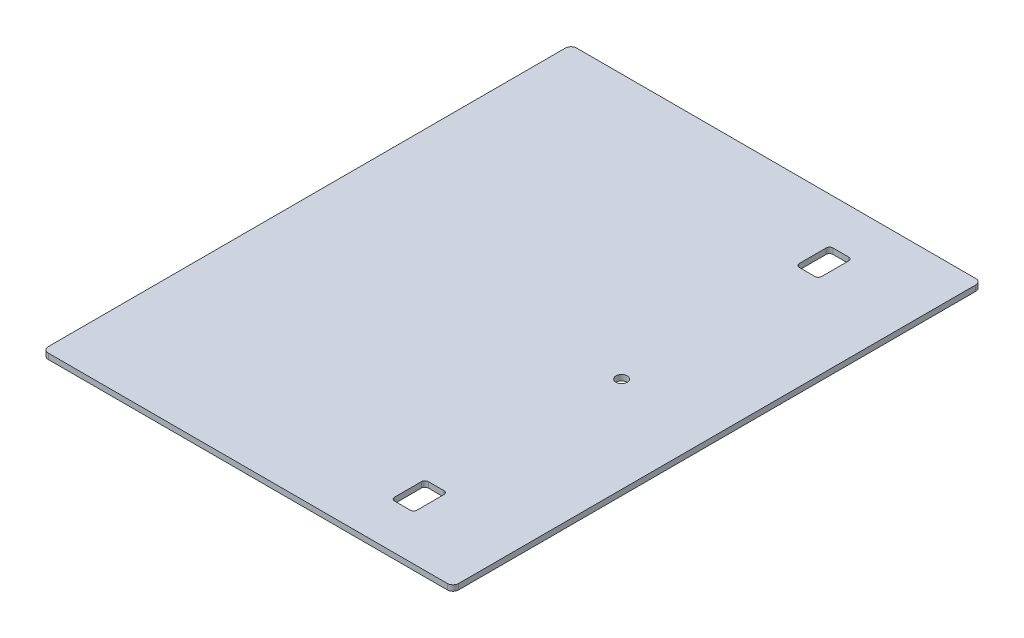
from build123d import *

# Parameters (mm, degrees)
SKETCH1_W                   = 231.775
SKETCH1_H                   = 298.45
BOSS_EXTRUDE1_DEPTH         = 3.175
F_1_4_0_25_DIAMETER_HOLE1_D = 6.35
FILLET1_R                   = 3.175
SKETCH4_W                   = 12.7
SKETCH4_H                   = 19.05
CUT_EXTRUDE1_DEPTH          = 189.96585381
FILLET2_R                   = 1.905


with BuildPart() as part:
    # Sketch1 → Boss-Extrude1 (new body)
    with BuildSketch(Plane(origin=(0, 0, 0), x_dir=(1, 0, 0), z_dir=(0, 1, 0))):
        Rectangle(SKETCH1_W, SKETCH1_H)
    extrude(amount=BOSS_EXTRUDE1_DEPTH)

    # 1/4 (0.25) Diameter Hole1 (through all)
    with Locations(Plane(origin=(0, 3.175, 0), x_dir=(1, 0, 0), z_dir=(0, 1, 0))):
        with Locations((61.9125, 0)):
            Hole(F_1_4_0_25_DIAMETER_HOLE1_D / 2)

    # Fillet1
    fillet1_edges = [part.edges().sort_by_distance(p)[0] for p in [
        (115.8875, 1.5875, 149.225),
        (-115.8875, 1.5875, 149.225),
        (-115.8875, 1.5875, -149.225),
        (115.8875, 1.5875, -149.225),
    ]]
    fillet(fillet1_edges, radius=FILLET1_R)

    # Sketch4 → Cut-Extrude1 (cut, through all)
    with BuildSketch(Plane(origin=(0, 3.175, 0), x_dir=(1, 0, 0), z_dir=(0, 1, 0))):
        with Locations((61.9125, -114.3)):
            Rectangle(SKETCH4_W, SKETCH4_H)
        with Locations((61.9125, 114.3)):
            Rectangle(SKETCH4_W, SKETCH4_H)
    extrude(amount=-CUT_EXTRUDE1_DEPTH, mode=Mode.SUBTRACT)

    # Fillet2
    fillet2_edges = [part.edges().sort_by_distance(p)[0] for p in [
        (55.5625, 1.5875, 123.825),
        (55.5625, 1.5875, 104.775),
        (68.2625, 1.5875, 104.775),
        (68.2625, 1.5875, 123.825),
        (55.5625, 1.5875, -104.775),
        (55.5625, 1.5875, -123.825),
        (68.2625, 1.5875, -123.825),
        (68.2625, 1.5875, -104.775),
    ]]
    fillet(fillet2_edges, radius=FILLET2_R)


solid = part.part
